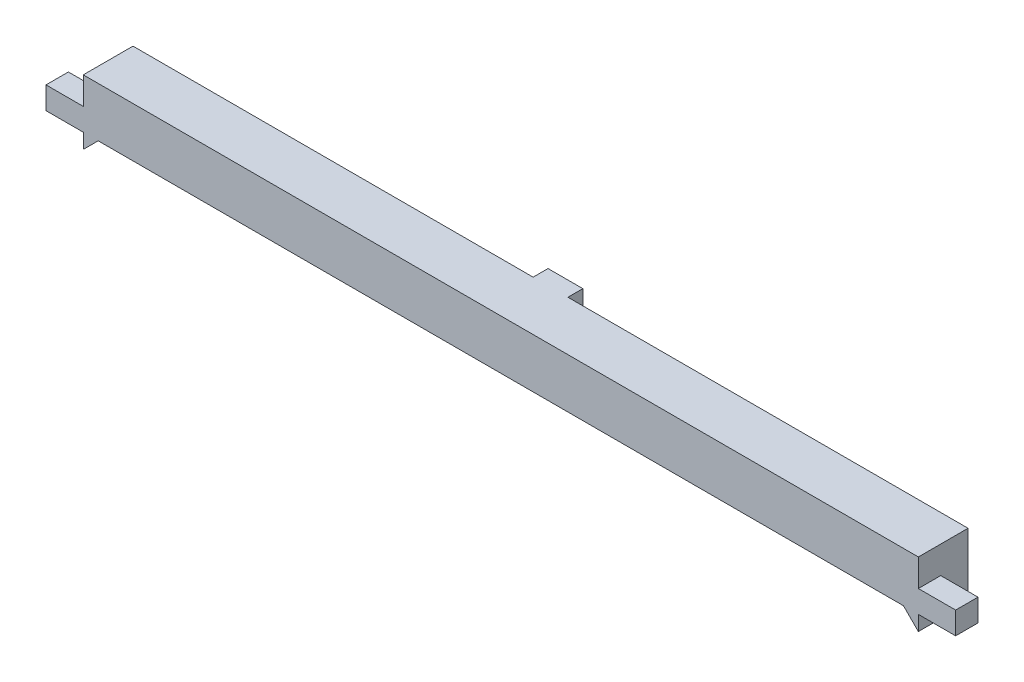
from build123d import *

# Parameters (mm, degrees)
EXTRUDE_1_DEPTH     = 26
SKETCH_1_4_W        = 4
SKETCH_1_4_H        = 340
EXTRUDE_2_DEPTH     = 19
FILLET_1_R          = 10
EXTRUDE_3_DEPTH     = 2
SKETCH_5_W          = 161
SKETCH_5_H          = 6
CUT_EXTRUDE_1_DEPTH = 52
CUT_EXTRUDE_2_DEPTH = 72
CUT_EXTRUDE_3_DEPTH = 72
CUT_EXTRUDE_4_DEPTH = 362
SKETCH_9_W          = 9
SKETCH_9_H          = 9
EXTRUDE_4_DEPTH     = 15
EXTRUDE_5_DEPTH     = 20


with BuildPart() as part:
    # 스케치1 → 보스-돌출1 (new body)
    with BuildSketch(Plane.XY):
        Polygon((-168, 0), (168, 0), (183, 0), (183, -340), (168, -340), (168, -20), (-168, -20), (-168, -340), (-183, -340), (-183, 0), align=None)
    extrude(amount=EXTRUDE_1_DEPTH)

    # 스케치1<4> → 보스-돌출2 (add)
    with BuildSketch(Plane.XY):
        with Locations((-170, -170)):
            Rectangle(SKETCH_1_4_W, SKETCH_1_4_H)
        with Locations((170, -170)):
            Rectangle(SKETCH_1_4_W, SKETCH_1_4_H)
    extrude(amount=-EXTRUDE_2_DEPTH)

    # 필렛1
    fillet_1_edges = [part.edges().sort_by_distance(p)[0] for p in [
        (-170, 0, -19),
        (170, 0, -19),
        (170, -340, -19),
        (-170, -340, -19),
    ]]
    fillet(fillet_1_edges, radius=FILLET_1_R)

    # 스케치3 → 보스-돌출3 (add)
    with BuildSketch(Plane.ZY.offset(-168)):
        with BuildLine():
            Line((-12, -339.539392014), (-12, -0.460607986))
            ThreePointArc((-12, -0.460607986), (-13.02408013, -0.845395743), (-14, -1.339745962))
            Line((-14, -1.339745962), (-14, -338.660254038))
            ThreePointArc((-14, -338.660254038), (-13.02408013, -339.154604257), (-12, -339.539392014))
        make_face()
    extrude_3 = extrude(amount=EXTRUDE_3_DEPTH)

    # 대칭 복사1: 보스-돌출3 across plane
    add(extrude_3.mirror(Plane(origin=(0, 0, 0), x_dir=(0, 0, 1), z_dir=(1, 0, 0))))

    # 스케치5 → 컷-돌출1 (cut)
    with BuildSketch(Plane(origin=(0, 0, 0), x_dir=(1, 0, 0), z_dir=(0, 1, 0))):
        with Locations((-87.5, -3)):
            Rectangle(SKETCH_5_W, SKETCH_5_H)
        with Locations((87.5, -3)):
            Rectangle(SKETCH_5_W, SKETCH_5_H)
    extrude(amount=-CUT_EXTRUDE_1_DEPTH, mode=Mode.SUBTRACT)

    # 스케치7 → 컷-돌출2 (cut)
    with BuildSketch(Plane.ZY.offset(-168)):
        with BuildLine():
            Line((26, 0), (-9, 0))
            ThreePointArc((-9, 0), (-16.071067812, -2.928932188), (-19, -10))
            Line((-19, -10), (-19, -330))
            ThreePointArc((-19, -330), (-16.071067812, -337.071067812), (-9, -340))
            Line((-9, -340), (26, -340))
            Line((26, -340), (26, 0))
        make_face()
    extrude(amount=-CUT_EXTRUDE_2_DEPTH, mode=Mode.SUBTRACT)


with BuildPart() as cut_extrude_2_piece_1:
    # of the separate pieces the step leaves, piece 1, a body of its own (cut_extrude_2_pieces)
    add(part.part.solids().sort_by_distance((168, 0, 26))[0])

    # 스케치8 → 컷-돌출3 (cut)
    with BuildSketch(Plane(origin=(-168, 0, 0), x_dir=(0, 0, -1), z_dir=(1, 0, 0))):
        with BuildLine():
            Line((9, 0), (-26, 0))
            Line((-26, 0), (-26, -340))
            Line((-26, -340), (9, -340))
            ThreePointArc((9, -340), (10.517576993, -339.884177258), (12, -339.539392014))
            Line((12, -339.539392014), (12, -0.460607986))
            ThreePointArc((12, -0.460607986), (10.517576993, -0.115822742), (9, 0))
        make_face()
    extrude(amount=-CUT_EXTRUDE_3_DEPTH, mode=Mode.SUBTRACT)


with BuildPart() as cut_extrude_2_piece_2:
    # of the separate pieces the step leaves, piece 2, a body of its own (cut_extrude_2_pieces)
    add(part.part.solids().sort_by_distance((168, -339.539392014, -12))[0])


with BuildPart() as cut_extrude_3_piece_1:
    # of the separate pieces the step leaves, piece 1, a body of its own (cut_extrude_3_pieces)
    add(cut_extrude_2_piece_1.part.solids().sort_by_distance((-168, 0, 26))[0])

    # 스케치9 → 보스-돌출4 (add)
    with BuildSketch(Plane(origin=(168, 0, 0), x_dir=(0, 0, -1), z_dir=(1, 0, 0))):
        with Locations((-21.5, -15.5)):
            Rectangle(SKETCH_9_W, SKETCH_9_H)
    extrude_4 = extrude(amount=EXTRUDE_4_DEPTH)

    # 대칭 복사2: 보스-돌출4 across plane
    add(extrude_4.mirror(Plane(origin=(0, 0, 0), x_dir=(0, 0, 1), z_dir=(1, 0, 0))))

    # 스케치10 → 보스-돌출5 (add)
    with BuildSketch(Plane.XY.offset(26)):
        Polygon((168, -20), (162, -20), (168, -26), align=None)
    extrude_5 = extrude(amount=-EXTRUDE_5_DEPTH)

    # 대칭 복사3: 보스-돌출5 across plane
    add(extrude_5.mirror(Plane(origin=(0, 0, 0), x_dir=(0, 0, 1), z_dir=(1, 0, 0))))


with BuildPart() as cut_extrude_3_piece_2:
    # of the separate pieces the step leaves, piece 2, a body of its own (cut_extrude_3_pieces)
    add(cut_extrude_2_piece_1.part.solids().sort_by_distance((-172, -0.460607986, -12))[0])


with BuildPart() as cut_extrude_4_tool:
    # 스케치7<3> → 컷-돌출4 (new body)
    with BuildSketch(Plane.ZY.offset(-168)):
        with BuildLine():
            Line((-12, -339.539392014), (-12, -0.460607986))
            ThreePointArc((-12, -0.460607986), (-17.062257748, -4.083920217), (-19, -10))
            Line((-19, -10), (-19, -330))
            ThreePointArc((-19, -330), (-17.062257748, -335.916079783), (-12, -339.539392014))
        make_face()
    extrude(amount=CUT_EXTRUDE_4_DEPTH)


with BuildPart() as cut_extrude_2_piece_2_1:
    add(cut_extrude_2_piece_2.part)

    # 컷-돌출4: cut by cut_extrude_4_tool
    add(cut_extrude_4_tool.part, mode=Mode.SUBTRACT)


with BuildPart() as cut_extrude_3_piece_2_1:
    add(cut_extrude_3_piece_2.part)

    # 컷-돌출4: cut by cut_extrude_4_tool
    add(cut_extrude_4_tool.part, mode=Mode.SUBTRACT)


solid = cut_extrude_3_piece_1.part
